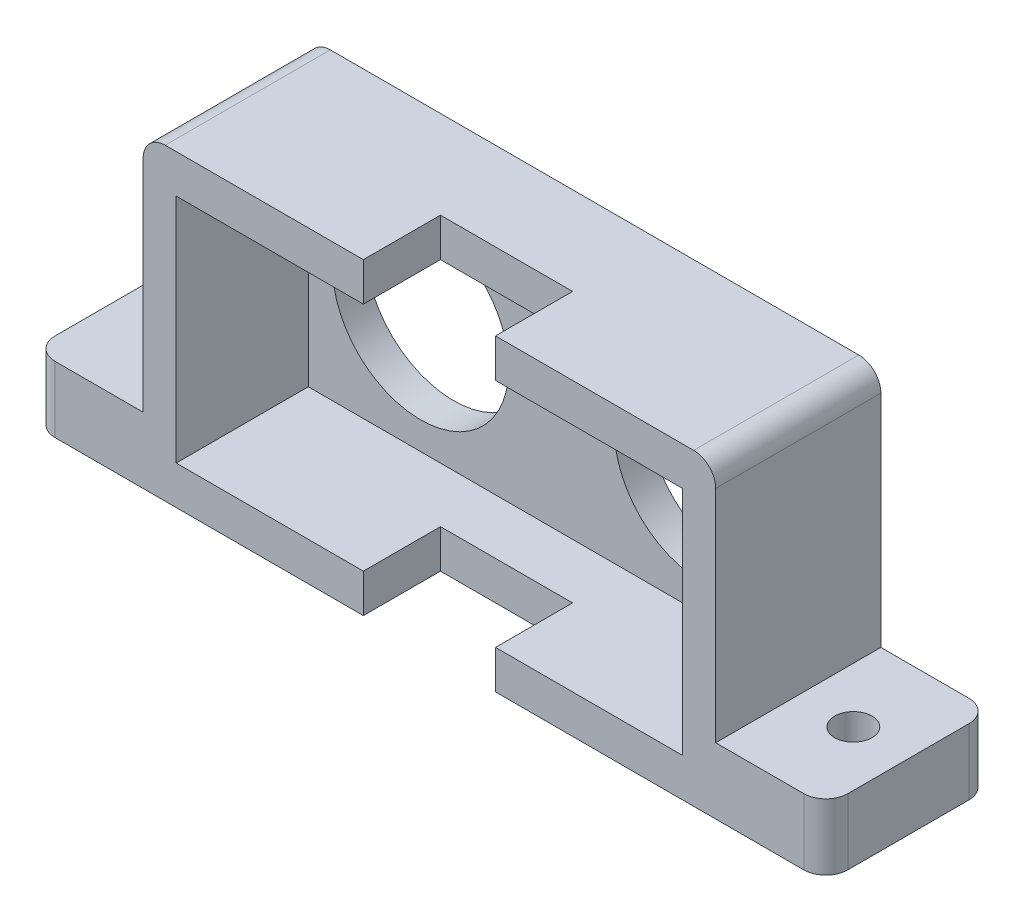
from build123d import *

# Parameters (mm, degrees)
BOSS_EXTRU_1_DEPTH      = 15
ESQUISSE2_W             = 46
ESQUISSE2_H             = 21
ENL_V_MAT_EXTRU_1_DEPTH = 12
ESQUISSE4_R             = 8
ENL_V_MAT_EXTRU_2_DEPTH = 3
ENL_V_MAT_EXTRU_3_REACH = 50.01
ESQUISSE5_W             = 12
ESQUISSE5_H             = 7
CONG_1_R                = 2
D_GAGEMENT_M31_D        = 3.4


with BuildPart() as part:
    # Esquisse1 → Boss.-Extru.1 (new body)
    with BuildSketch(Plane.XY):
        Polygon((36, 0), (-36, 0), (-36, 6), (-26, 6), (-26, 28), (26, 28), (26, 6), (36, 6), align=None)
    extrude(amount=BOSS_EXTRU_1_DEPTH)

    # Esquisse2 → Enlèv. mat.-Extru.1 (cut)
    with BuildSketch(Plane.XY.offset(15)):
        with Locations((0, 14)):
            Rectangle(ESQUISSE2_W, ESQUISSE2_H)
    extrude(amount=-ENL_V_MAT_EXTRU_1_DEPTH, mode=Mode.SUBTRACT)

    # Esquisse4 → Enlèv. mat.-Extru.2 (cut)
    with BuildSketch(Plane.XY.offset(3)):
        with Locations((-12.8, 14)):
            Circle(ESQUISSE4_R)
        with Locations((12.8, 14)):
            Circle(ESQUISSE4_R)
    extrude(amount=-ENL_V_MAT_EXTRU_2_DEPTH, mode=Mode.SUBTRACT)

    # Enlèv. mat.-Extru.3: up to this face of the body (flat: up to its plane)
    enl_v_mat_extru_3_end = Plane(part.part.faces().sort_by_distance((0, 28, 7.5))[0])
    # Esquisse5 → Enlèv. mat.-Extru.3 (cut, up to the picked face)
    with BuildSketch(Plane.XZ, mode=Mode.PRIVATE) as enl_v_mat_extru_3_sk1:
        with Locations((0, 11.5)):
            Rectangle(ESQUISSE5_W, ESQUISSE5_H)
    enl_v_mat_extru_3_tool1 = split(extrude(enl_v_mat_extru_3_sk1.sketch, amount=-ENL_V_MAT_EXTRU_3_REACH, mode=Mode.PRIVATE), bisect_by=enl_v_mat_extru_3_end, keep=Keep.BOTH, mode=Mode.PRIVATE)
    add(enl_v_mat_extru_3_tool1.solids().sort_by(Axis((0, 0, 11.5), (0, 1, 0)))[0], mode=Mode.SUBTRACT)

    # Congé1
    cong_1_edges = [part.edges().sort_by_distance(p)[0] for p in [
        (36, 3, 0),
        (-36, 3, 0),
        (36, 3, 15),
        (-26, 28, 7.5),
        (26, 28, 7.5),
        (-36, 3, 15),
    ]]
    fillet(cong_1_edges, radius=CONG_1_R)

    # Dégagement M31 (through all)
    with Locations(Plane(origin=(0, 6, 0), x_dir=(1, 0, 0), z_dir=(0, 1, 0))):
        with Locations((-31, -7.5), (31, -7.5)):
            Hole(D_GAGEMENT_M31_D / 2)


solid = part.part
